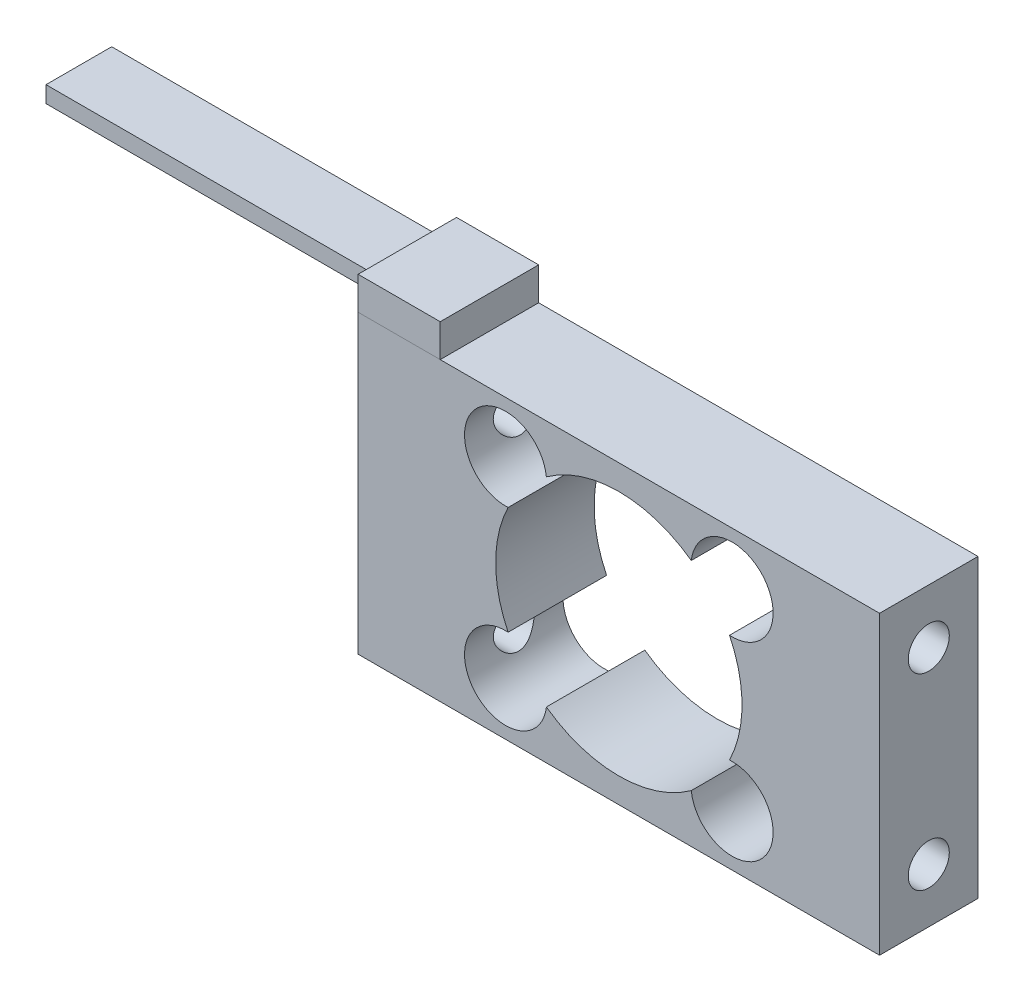
from build123d import *

# Parameters (mm, degrees)
SKETCH1_W                  = 31.75
SKETCH1_H                  = 18.034
BOSS_EXTRUDE1_DEPTH        = 2.9972
M3_TAPPED_HOLE1_AT_2_COUNT = 2
M3_TAPPED_HOLE1_AT_2_PITCH = 11.43
CUT_EXTRUDE1_DEPTH         = 19.501489719
CUT_EXTRUDE1_DEPTH_BACK    = 19.501489719
SKETCH4_R                  = 7.5
SKETCH5_R                  = 2.5
CUT_EXTRUDE2_DEPTH         = 19.501489719
MIRROR3_COPY_1_SKETCH_R    = 2.5
MIRROR3_COPY_1_DEPTH       = 19.501489719
SKETCH6_W                  = 5
SKETCH6_H                  = 5.9944
BOSS_EXTRUDE2_DEPTH        = 2
SKETCH7_W                  = 4
SKETCH7_H                  = 1
BOSS_EXTRUDE3_DEPTH        = 20


with BuildPart() as part:
    # Sketch1 → Boss-Extrude1 (new, symmetric)
    with BuildSketch(Plane.XY):
        Rectangle(SKETCH1_W, SKETCH1_H)
    extrude(amount=BOSS_EXTRUDE1_DEPTH, both=True)

    # Sketch3 → M3 Tapped Hole1 (revolve, cut)
    with BuildSketch(Plane(origin=(15.875, 5.715, 0), x_dir=(0, 0, -1), z_dir=(0, 1, 0))):
        Polygon((0, 0), (0, 9.251075774), (1.25, 8.5), (1.25, 0), align=None)
    m3_tapped_hole1 = revolve(axis=Axis((22.225, 5.715, 0), (-1, 0, 0)), mode=Mode.SUBTRACT)

    # M3 Tapped Hole1 at 2: M3 Tapped Hole1 ×2
    with Locations(*[(0, -i * M3_TAPPED_HOLE1_AT_2_PITCH, 0) for i in range(1, M3_TAPPED_HOLE1_AT_2_COUNT)]):
        add(m3_tapped_hole1, mode=Mode.SUBTRACT)

    # Mirror1: M3 Tapped Hole1 across plane
    add(m3_tapped_hole1.mirror(Plane(origin=(0, 0, 0), x_dir=(0, 0, 1), z_dir=(1, 0, 0))), mode=Mode.SUBTRACT)

    # Mirror1 copy 1 sketch → Mirror1 copy 1 (revolve, cut)
    with BuildSketch(Plane(origin=(-15.875, -5.715, 0), x_dir=(0, 0, -1), z_dir=(0, 1, 0))):
        Polygon((0, 0), (0, -9.251075774), (1.25, -8.5), (1.25, 0), align=None)
    revolve(axis=Axis((-22.225, -5.715, 0), (-1, 0, 0)), mode=Mode.SUBTRACT)

    # Sketch4 → Cut-Extrude1 (cut, two sides: drawn at the far end of the back side and taken through both)
    with BuildSketch(Plane.XY.offset(-CUT_EXTRUDE1_DEPTH_BACK)):
        Circle(SKETCH4_R)
    extrude(amount=CUT_EXTRUDE1_DEPTH + CUT_EXTRUDE1_DEPTH_BACK, mode=Mode.SUBTRACT)

    # Sketch5 → Cut-Extrude2 (cut, symmetric)
    with BuildSketch(Plane.XY):
        with Locations((-6.894399988, 5.785088487)):
            Circle(SKETCH5_R)
    cut_extrude2 = extrude(amount=CUT_EXTRUDE2_DEPTH, both=True, mode=Mode.SUBTRACT)

    # Mirror2: Cut-Extrude2 across plane
    add(cut_extrude2.mirror(Plane.ZX), mode=Mode.SUBTRACT)

    # Mirror3: Cut-Extrude2 across plane
    add(cut_extrude2.mirror(Plane(origin=(0, 0, 0), x_dir=(0, 0, 1), z_dir=(1, 0, 0))), mode=Mode.SUBTRACT)

    # Mirror3 copy 1 sketch → Mirror3 copy 1 (cut, symmetric)
    with BuildSketch(Plane(origin=(0, 0, 0), x_dir=(-1, 0, 0), z_dir=(0, 0, 1))):
        with Locations((-6.894399988, 5.785088487)):
            Circle(MIRROR3_COPY_1_SKETCH_R)
    extrude(amount=MIRROR3_COPY_1_DEPTH, both=True, mode=Mode.SUBTRACT)


with BuildPart() as body_2:
    # Sketch6 → Boss-Extrude2 (new body)
    with BuildSketch(Plane(origin=(0, 9.017, 0), x_dir=(1, 0, 0), z_dir=(0, 1, 0))):
        with Locations((-13.375, 0)):
            Rectangle(SKETCH6_W, SKETCH6_H)
    extrude(amount=BOSS_EXTRUDE2_DEPTH)

    # Sketch7 → Boss-Extrude3 (add)
    with BuildSketch(Plane.ZY.offset(15.875)):
        with Locations((0, 10.017)):
            Rectangle(SKETCH7_W, SKETCH7_H)
    extrude(amount=BOSS_EXTRUDE3_DEPTH)


solid = Compound([part.part, body_2.part])
